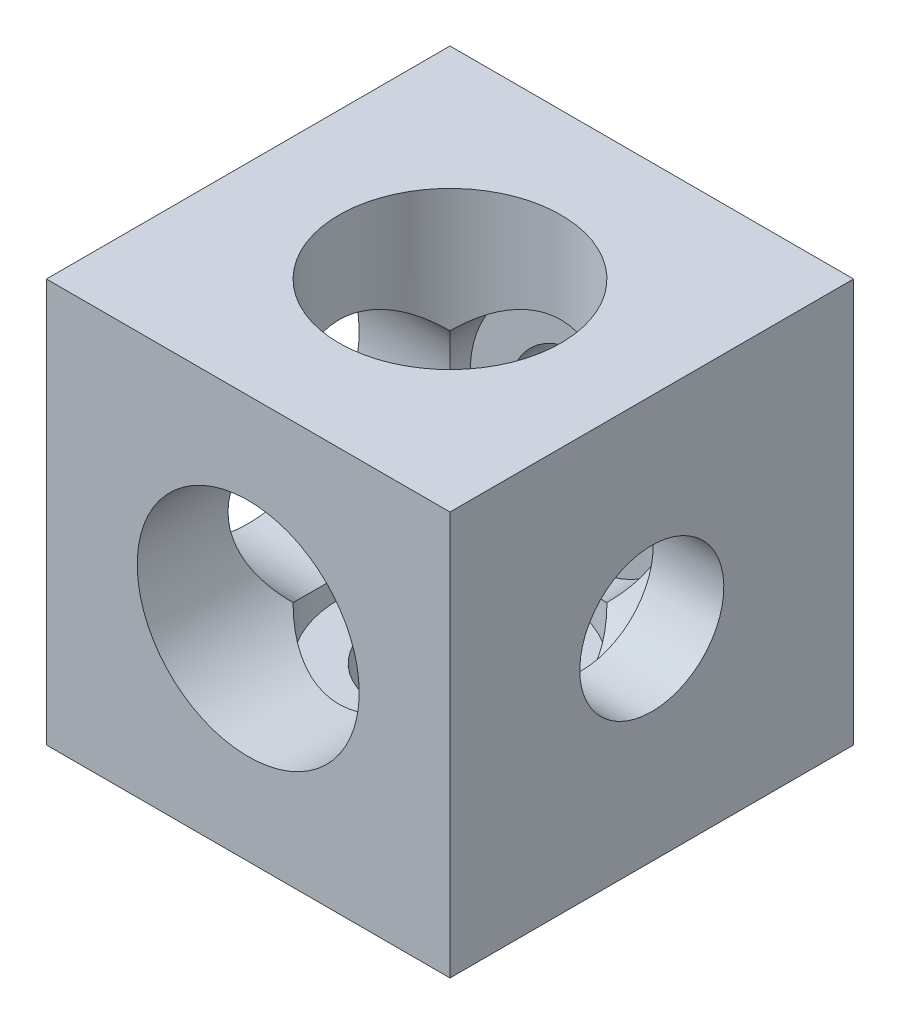
from build123d import *

# Parameters (mm, degrees)
SKETCH1_W           = 20
SKETCH1_H           = 20
BOSS_EXTRUDE1_DEPTH = 10
SKETCH2_R           = 3.57
CUT_EXTRUDE1_DEPTH  = 25.494897428
SKETCH3_R           = 5.5
CUT_EXTRUDE2_DEPTH  = 16.5
SKETCH4_R           = 3.57
CUT_EXTRUDE3_DEPTH  = 25.494897428
SKETCH5_R           = 5.5
CUT_EXTRUDE4_DEPTH  = 16.5
SKETCH6_R           = 3.57
CUT_EXTRUDE5_DEPTH  = 25.494897428
SKETCH7_R           = 5.5
CUT_EXTRUDE6_DEPTH  = 16.5


with BuildPart() as part:
    # Sketch1 → Boss-Extrude1 (new, symmetric)
    with BuildSketch(Plane.XY):
        Rectangle(SKETCH1_W, SKETCH1_H)
    extrude(amount=BOSS_EXTRUDE1_DEPTH, both=True)

    # Sketch2 → Cut-Extrude1 (cut, through all)
    with BuildSketch(Plane.XY.offset(10)):
        Circle(SKETCH2_R)
    extrude(amount=-CUT_EXTRUDE1_DEPTH, mode=Mode.SUBTRACT)

    # Sketch3 → Cut-Extrude2 (cut)
    with BuildSketch(Plane.XY.offset(10)):
        Circle(SKETCH3_R)
    extrude(amount=-CUT_EXTRUDE2_DEPTH, mode=Mode.SUBTRACT)

    # Sketch4 → Cut-Extrude3 (cut, through all)
    with BuildSketch(Plane.ZY.offset(10)):
        with Locations(Location((0, 0, 0), (0, 0, 270))):
            Circle(SKETCH4_R)
    extrude(amount=-CUT_EXTRUDE3_DEPTH, mode=Mode.SUBTRACT)

    # Sketch5 → Cut-Extrude4 (cut)
    with BuildSketch(Plane.ZY.offset(10)):
        with Locations(Location((0, 0, 0), (0, 0, 270))):
            Circle(SKETCH5_R)
    extrude(amount=-CUT_EXTRUDE4_DEPTH, mode=Mode.SUBTRACT)

    # Sketch6 → Cut-Extrude5 (cut, through all)
    with BuildSketch(Plane(origin=(0, 10, 0), x_dir=(1, 0, 0), z_dir=(0, 1, 0))):
        with Locations(Location((0, 0, 0), (0, 0, 270))):
            Circle(SKETCH6_R)
    extrude(amount=-CUT_EXTRUDE5_DEPTH, mode=Mode.SUBTRACT)

    # Sketch7 → Cut-Extrude6 (cut)
    with BuildSketch(Plane(origin=(0, 10, 0), x_dir=(1, 0, 0), z_dir=(0, 1, 0))):
        with Locations(Location((0, 0, 0), (0, 0, 270))):
            Circle(SKETCH7_R)
    extrude(amount=-CUT_EXTRUDE6_DEPTH, mode=Mode.SUBTRACT)


solid = part.part
